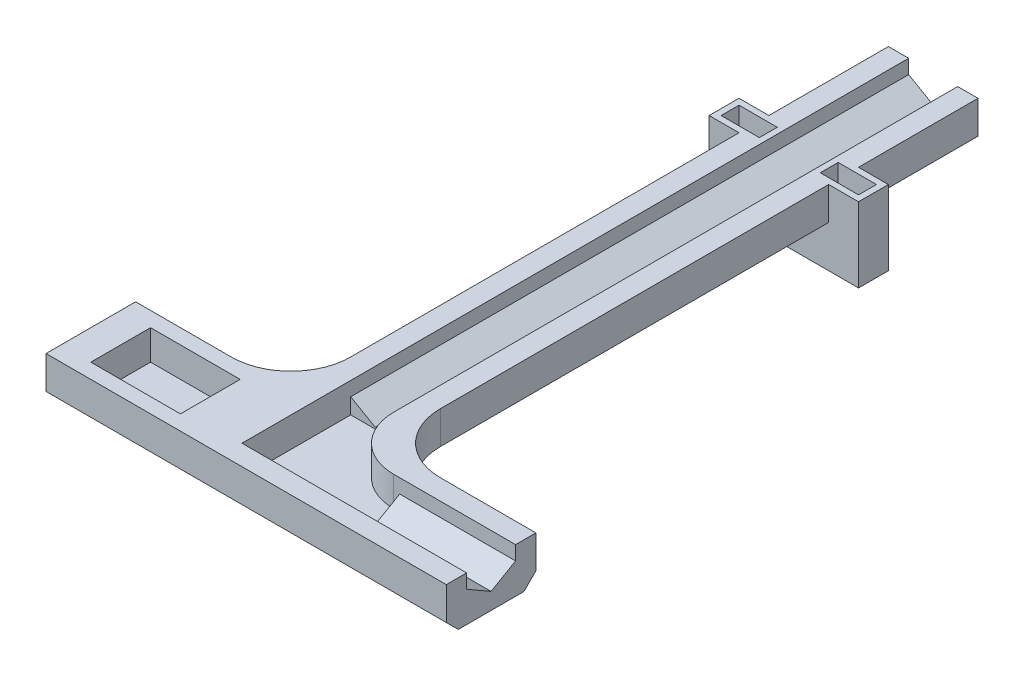
from build123d import *

# Parameters (mm, degrees)
BOSS_EXTRUDE1_DEPTH = 7.5
CUT_EXTRUDE6_DEPTH  = 5
BOSS_EXTRUDE2_START = -20
BOSS_EXTRUDE2_DEPTH = 5
CHAMFER1_SIZE       = 2
SKETCH11_W          = 15
SKETCH11_H          = 10
SKETCH11_W_2        = 6.4
SKETCH11_H_2        = 3
CUT_EXTRUDE7_DEPTH  = 5


with BuildPart() as part:
    # Sketch1 → Boss-Extrude1 (new body)
    with BuildSketch(Plane(origin=(0, 0, 0), x_dir=(1, 0, 0), z_dir=(0, 1, 0))):
        with BuildLine():
            Line((0, 0), (0, 15))
            Line((0, 15), (16, 15))
            ThreePointArc((16, 15), (23.071067812, 17.928932188), (26, 25))
            Line((26, 25), (26, 115))
            Line((26, 115), (41, 115))
            Line((41, 115), (41, 25))
            ThreePointArc((41, 25), (43.928932188, 17.928932188), (51, 15))
            Line((51, 15), (67, 15))
            Line((67, 15), (67, 0))
            Line((67, 0), (0, 0))
        make_face()
    extrude(amount=BOSS_EXTRUDE1_DEPTH)

    # Cut-Sweep1: sweep along a path in Sketch2
    with BuildLine(Plane(origin=(0, 7.5, 0), x_dir=(1, 0, 0), z_dir=(0, 1, 0))) as cut_sweep1_path:
        Line((33.5, 115), (33.5, 7.5))
        Line((33.5, 7.5), (67, 7.5))
    # Sketch3 → Cut-Sweep1 (sweep, cut)
    with BuildSketch(Plane(origin=(0, 0, -115), x_dir=(-1, 0, 0), z_dir=(0, 0, -1))):
        Polygon((-37.6, 5.132863896), (-33.5, 2.765727793), (-29.4, 5.132863896), (-29.4, 9.867136104), (-33.5, 12.234272207), (-37.6, 9.867136104), align=None)
    sweep(path=cut_sweep1_path.line, transition=Transition.RIGHT, mode=Mode.SUBTRACT)

    # Sketch7 → Cut-Extrude6 (cut)
    with BuildSketch(Plane(origin=(0, 7.5, 0), x_dir=(1, 0, 0), z_dir=(0, 1, 0))):
        with BuildLine():
            Line((47.6, 11.6), (47.6, 3.4))
            Line((47.6, 3.4), (29.4, 3.4))
            Line((29.4, 3.4), (29.4, 21.6))
            Line((29.4, 21.6), (37.6, 21.6))
            Line((37.6, 21.6), (37.6, 20.6))
            ThreePointArc((37.6, 20.6), (40.236038969, 14.236038969), (46.6, 11.6))
            Line((46.6, 11.6), (47.6, 11.6))
        make_face()
    extrude(amount=-CUT_EXTRUDE6_DEPTH, mode=Mode.SUBTRACT)

    # Sketch10 → Boss-Extrude2 (add)
    with BuildSketch(Plane(origin=(0, 0, -115), x_dir=(-1, 0, 0), z_dir=(0, 0, -1)).offset(BOSS_EXTRUDE2_START)):
        Polygon((-41, 7.5), (-46, 7.5), (-46, -5), (-21, -5), (-21, 7.5), (-26, 7.5), (-26, 0), (-41, 0), align=None)
    extrude(amount=-BOSS_EXTRUDE2_DEPTH)

    # Chamfer1
    chamfer1_edges = [part.edges().sort_by_distance(p)[0] for p in [
        (26, 0, -57.5),
        (41, 0, -105),
        (33.5, 0, 0),
        (8, 0, -15),
        (23.071067812, 0, -17.928932188),
        (26, 0, -105),
        (41, 0, -57.5),
        (43.928932188, 0, -17.928932188),
        (59, 0, -15),
    ]]
    chamfer(chamfer1_edges, length=CHAMFER1_SIZE)

    # Sketch11 → Cut-Extrude7 (cut)
    with BuildSketch(Plane(origin=(0, 7.5, 0), x_dir=(1, 0, 0), z_dir=(0, 1, 0))):
        with Locations((12.5, 7.5)):
            Rectangle(SKETCH11_W, SKETCH11_H)
        with Locations((25.2, 92.5)):
            Rectangle(SKETCH11_W_2, SKETCH11_H_2)
        with Locations((41.8, 92.5)):
            Rectangle(SKETCH11_W_2, SKETCH11_H_2)
    extrude(amount=-CUT_EXTRUDE7_DEPTH, mode=Mode.SUBTRACT)


solid = part.part
